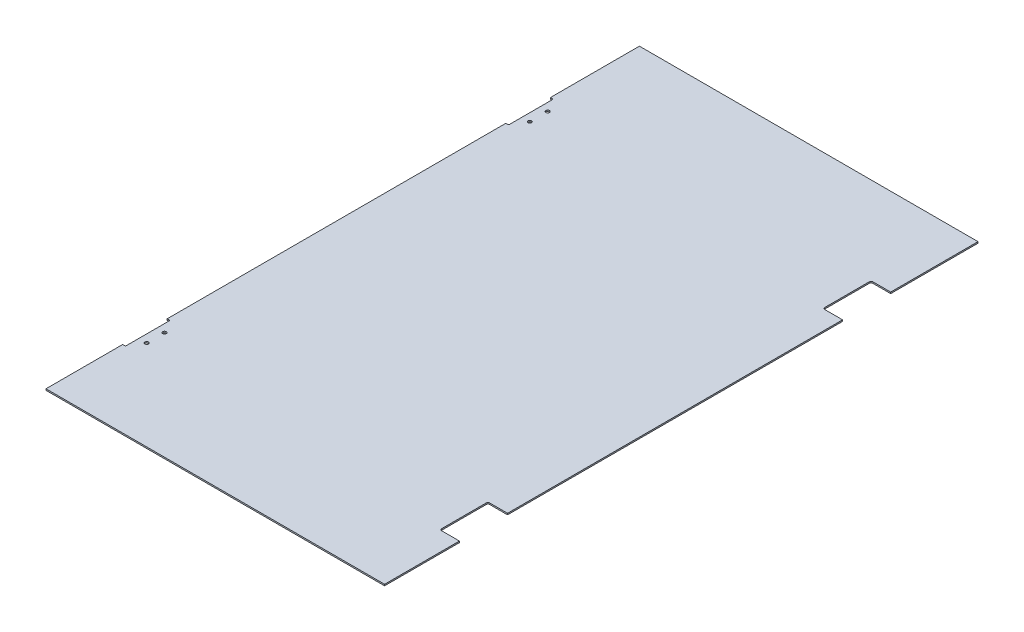
from build123d import *

# Parameters (mm, degrees)
PANEL_DEPTH        = 0.79
SKETCH5_R          = 1
HINGE_MOUNT_DEPTH  = 10
HINGE_CUTOUT_DEPTH = 10


with BuildPart() as part:
    # Sketch1 → Panel (new body)
    with BuildSketch(Plane(origin=(0, 0, 0), x_dir=(1, 0, 0), z_dir=(0, 1, 0))):
        Polygon((65.326251897, 149.069802731), (95.326251897, 149.069802731), (95.326251897, -183.930197269), (-94.673748103, -183.930197269), (-94.673748103, 149.069802731), (-64.673748103, 149.069802731), (-39.673748103, 149.069802731), (40.326251897, 149.069802731), align=None)
    extrude(amount=PANEL_DEPTH)

    # Sketch5 → Hinge Mount (cut)
    with BuildSketch(Plane.XZ):
        with Locations(Location((-88.673748103, -91.569802731, 0), (0, 0, 270))):
            Circle(SKETCH5_R)
        with Locations(Location((-88.673748103, -81.569802731, 0), (0, 0, 270))):
            Circle(SKETCH5_R)
        with BuildLine():
            Line((-94.673748103, -99.069802731), (-93.593748103, -99.069802731))
            ThreePointArc((-93.593748103, -99.069802731), (-93.240194713, -98.923356122), (-93.093748103, -98.569802731))
            Line((-93.093748103, -98.569802731), (-93.093748103, -74.569802731))
            ThreePointArc((-93.093748103, -74.569802731), (-93.240194713, -74.216249341), (-93.593748103, -74.069802731))
            Line((-93.593748103, -74.069802731), (-94.673748103, -74.069802731))
            Line((-94.673748103, -74.069802731), (-94.673748103, -99.069802731))
        make_face()
    hinge_mount = extrude(amount=-HINGE_MOUNT_DEPTH, mode=Mode.SUBTRACT)

    # Sketch6 → Hinge Cutout (cut)
    with BuildSketch(Plane.XZ):
        with BuildLine():
            Line((95.326251897, -100.069802731), (85.326251897, -100.069802731))
            ThreePointArc((85.326251897, -100.069802731), (84.619145116, -99.776909513), (84.326251897, -99.069802731))
            Line((84.326251897, -99.069802731), (84.326251897, -74.069802731))
            ThreePointArc((84.326251897, -74.069802731), (84.619145116, -73.36269595), (85.326251897, -73.069802731))
            Line((85.326251897, -73.069802731), (95.326251897, -73.069802731))
            Line((95.326251897, -73.069802731), (95.326251897, -100.069802731))
        make_face()
    hinge_cutout = extrude(amount=-HINGE_CUTOUT_DEPTH, mode=Mode.SUBTRACT)

    # Mirror1: Hinge Mount, Hinge Cutout across plane
    add(hinge_mount.mirror(Plane(origin=(0, 0, 20.930197269), x_dir=(1, 0, 0), z_dir=(0, 0, -1))), mode=Mode.SUBTRACT)
    add(hinge_cutout.mirror(Plane(origin=(0, 0, 20.930197269), x_dir=(1, 0, 0), z_dir=(0, 0, -1))), mode=Mode.SUBTRACT)


solid = part.part
